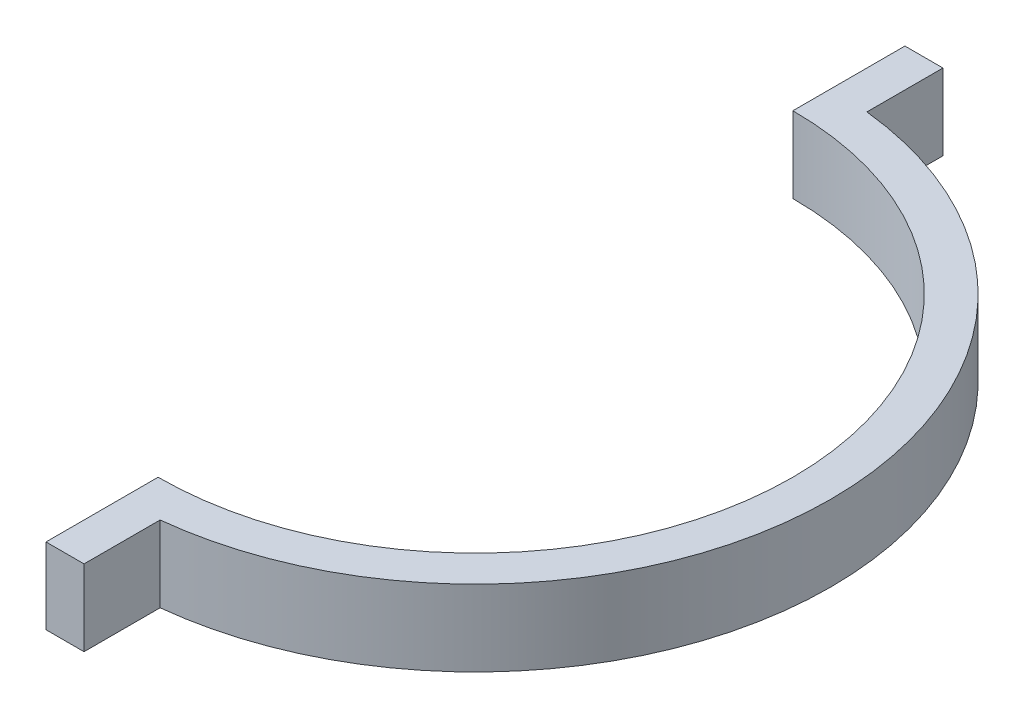
from build123d import *

# Parameters (mm, degrees)
BOSS_EXTRUDE1_DEPTH = 12.7


with BuildPart() as part:
    # Sketch1 → Boss-Extrude1 (new body)
    with BuildSketch(Plane(origin=(0, 0, 0), x_dir=(1, 0, 0), z_dir=(0, 1, 0))):
        with BuildLine():
            Line((0, 52.991305342), (0, 71.700576435))
            Line((0, 71.700576435), (6.35, 71.700576435))
            Line((6.35, 71.700576435), (6.35, 59.000576435))
            ThreePointArc((6.35, 59.000576435), (59.341305342, 0), (6.35, -59.000576435))
            Line((6.35, -59.000576435), (6.35, -71.700576435))
            Line((6.35, -71.700576435), (0, -71.700576435))
            Line((0, -71.700576435), (0, -52.991305342))
            ThreePointArc((0, -52.991305342), (52.991305342, 0), (0, 52.991305342))
        make_face()
    extrude(amount=BOSS_EXTRUDE1_DEPTH)


solid = part.part
